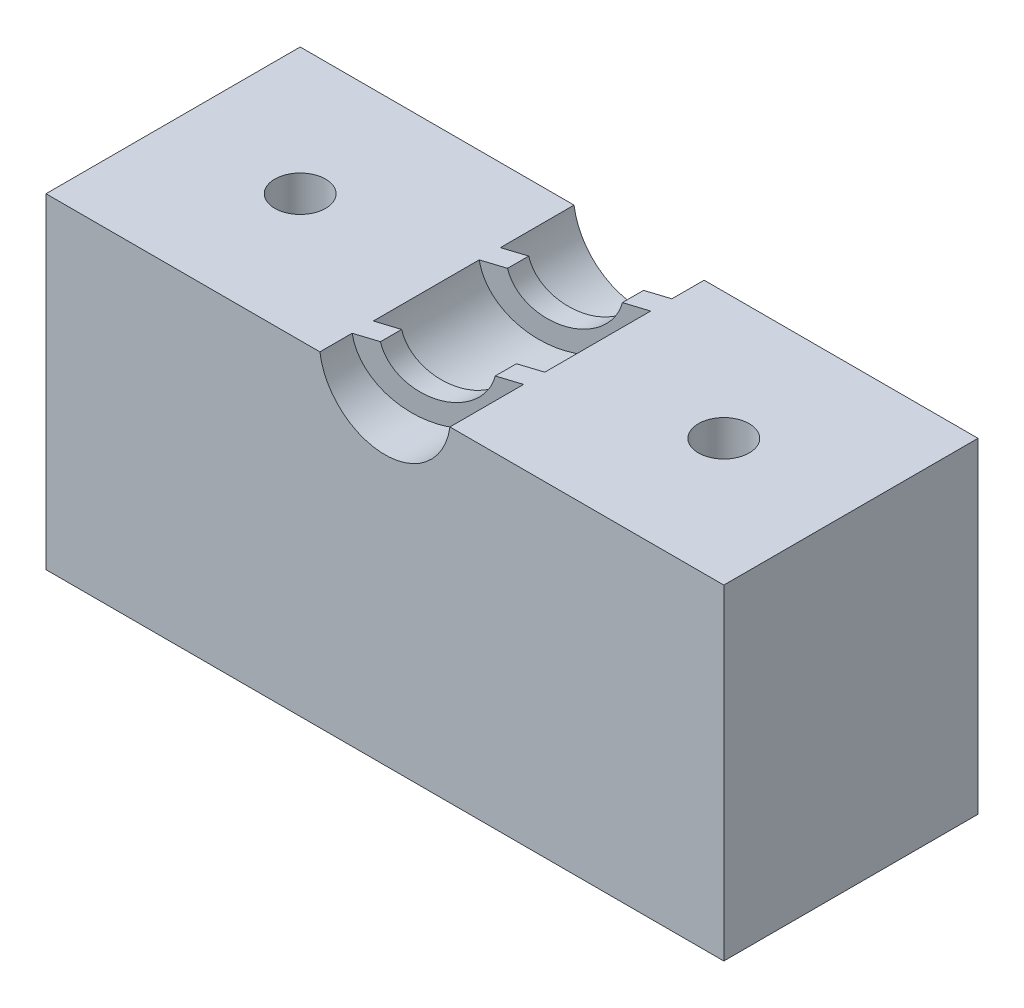
from build123d import *

# Parameters (mm, degrees)
SKETCH_1_W               = 16
SKETCH_1_H               = 16
SKETCH_1_R               = 1.55
EXTRUDE_1_DEPTH          = 3
EXTRUDE_2_DEPTH          = 8
CUT_EXTRUDE_2_DEPTH      = 12.704699911
CUT_EXTRUDE_2_DEPTH_BACK = 12.704699911
SKETCH_8_R               = 0.6
CUT_EXTRUDE_3_DEPTH      = 12.704699911
CUT_EXTRUDE_START        = -0.1
SKETCH_10_W              = 16
SKETCH_10_H              = 6
SKETCH_10_R              = 0.6
CUT_EXTRUDE_7_DEPTH      = 0.1


with BuildPart() as part:
    # 草图1 → 凸台-拉伸1 (new, symmetric)
    with BuildSketch(Plane.XY):
        Rectangle(SKETCH_1_W, SKETCH_1_H)
        Circle(SKETCH_1_R, mode=Mode.SUBTRACT)
    extrude(amount=EXTRUDE_1_DEPTH, both=True)

    # 草图6 → 凸台-拉伸2 (add)
    with BuildSketch(Plane(origin=(0, 0, 0), x_dir=(1, 0, 0), z_dir=(0, 1, 0))):
        Polygon((-1.55, -1.743476048), (-1.55, -2.243476048), (1.55, -1.256523952), (1.55, -0.756523952), align=None)
        Polygon((-1.55, 1.256523952), (-1.55, 0.756523952), (1.55, 1.743476048), (1.55, 2.243476048), align=None)
    extrude(amount=-EXTRUDE_2_DEPTH)

    # 草图7 → 切除-拉伸2 (cut, two sides: drawn at the far end of the back side and taken through both)
    with BuildSketch(Plane.XY.offset(-CUT_EXTRUDE_2_DEPTH_BACK)):
        with BuildLine():
            Line((-8, -0.214092961), (-1.027941732, -0.214092961))
            ThreePointArc((-1.027941732, -0.214092961), (-0.107613153, 1.044470875), (1.05, 0))
            ThreePointArc((1.05, 0), (1.044470875, -0.107613153), (1.027941732, -0.214092961))
            Line((1.027941732, -0.214092961), (8, -0.214092961))
            Line((8, -0.214092961), (8, 8))
            Line((8, 8), (-8, 8))
            Line((-8, 8), (-8, -0.214092961))
        make_face()
        with BuildLine():
            Line((1.027941732, -0.214092961), (0, 0))
            Line((0, 0), (-1.027941732, -0.214092961))
            ThreePointArc((-1.027941732, -0.214092961), (0, -1.05), (1.027941732, -0.214092961))
        make_face()
        with BuildLine():
            Line((-1.027941732, -0.214092961), (0, 0))
            Line((0, 0), (1.027941732, -0.214092961))
            ThreePointArc((1.027941732, -0.214092961), (1.044470875, -0.107613153), (1.05, 0))
            ThreePointArc((1.05, 0), (-0.107613153, 1.044470875), (-1.027941732, -0.214092961))
        make_face()
    extrude(amount=CUT_EXTRUDE_2_DEPTH + CUT_EXTRUDE_2_DEPTH_BACK, mode=Mode.SUBTRACT)

    # 草图8 → 切除-拉伸3 (cut, through all)
    with BuildSketch(Plane(origin=(0, 0, 0), x_dir=(1, 0, 0), z_dir=(0, 1, 0))):
        with Locations(Location((-5, 0, 0), (0, 0, 270))):
            Circle(SKETCH_8_R)
        with Locations(Location((5, 0, 0), (0, 0, 270))):
            Circle(SKETCH_8_R)
    extrude(amount=-CUT_EXTRUDE_3_DEPTH, mode=Mode.SUBTRACT)

    # 草图10 → 切除-拉伸7 (cut)
    with BuildSketch(Plane.XZ.offset(8).offset(CUT_EXTRUDE_START)):
        Rectangle(SKETCH_10_W, SKETCH_10_H)
        with Locations(Location((-5, 0, 0), (0, 0, 180))):
            Circle(SKETCH_10_R, mode=Mode.SUBTRACT)
        with Locations((5, 0)):
            Circle(SKETCH_10_R, mode=Mode.SUBTRACT)
    extrude(amount=CUT_EXTRUDE_7_DEPTH, mode=Mode.SUBTRACT)


solid = part.part
